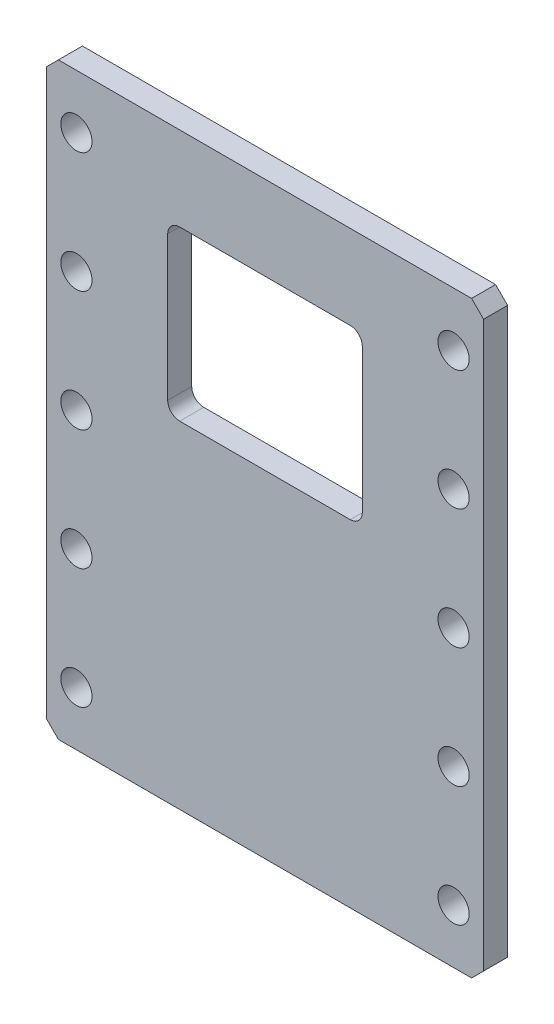
from build123d import *

# Parameters (mm, degrees)
SKETCH_1_W          = 364
SKETCH_1_H          = 490
EXTRUDE_1_DEPTH     = 20
SKETCH_2_R          = 13
CUT_EXTRUDE_1_DEPTH = 306.857810101
CHAMFER_1_SIZE      = 10


with BuildPart() as part:
    # 草图1 → 凸台-拉伸1 (new body)
    with BuildSketch(Plane.XY):
        Rectangle(SKETCH_1_W, SKETCH_1_H)
    extrude(amount=EXTRUDE_1_DEPTH)

    # 草图2 → 切除-拉伸1 (cut, through all)
    with BuildSketch(Plane.XY.offset(20)):
        with Locations((-157, 200)):
            Circle(SKETCH_2_R)
        with Locations((-157, 100)):
            Circle(SKETCH_2_R)
        with Locations((-157, 0)):
            Circle(SKETCH_2_R)
        with Locations((-157, -100)):
            Circle(SKETCH_2_R)
        with Locations((-157, -200)):
            Circle(SKETCH_2_R)
        with Locations(Location((157, -200, 0), (0, 0, 180))):
            Circle(SKETCH_2_R)
        with Locations(Location((157, -100, 0), (0, 0, 180))):
            Circle(SKETCH_2_R)
        with Locations(Location((157, 0, 0), (0, 0, 180))):
            Circle(SKETCH_2_R)
        with Locations(Location((157, 100, 0), (0, 0, 180))):
            Circle(SKETCH_2_R)
        with Locations(Location((157, 200, 0), (0, 0, 180))):
            Circle(SKETCH_2_R)
        with BuildLine():
            Line((-71, 175), (71, 175))
            ThreePointArc((71, 175), (78.071067812, 172.071067812), (81, 165))
            Line((81, 165), (81, 45))
            ThreePointArc((81, 45), (78.071067812, 37.928932188), (71, 35))
            Line((71, 35), (-71, 35))
            ThreePointArc((-71, 35), (-78.071067812, 37.928932188), (-81, 45))
            Line((-81, 45), (-81, 165))
            ThreePointArc((-81, 165), (-78.071067812, 172.071067812), (-71, 175))
        make_face()
    extrude(amount=-CUT_EXTRUDE_1_DEPTH, mode=Mode.SUBTRACT)

    # 倒角1
    chamfer_1_edges = [part.edges().sort_by_distance(p)[0] for p in [
        (182, -245, 10),
        (-182, -245, 10),
        (-182, 245, 10),
        (182, 245, 10),
    ]]
    chamfer(chamfer_1_edges, length=CHAMFER_1_SIZE)


solid = part.part
